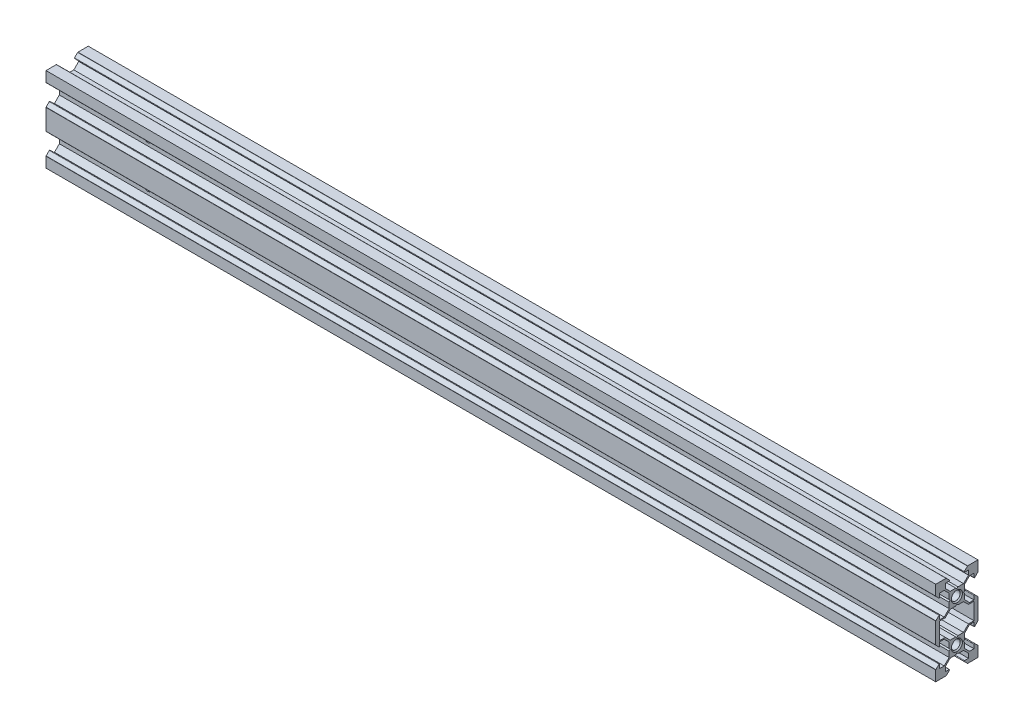
from build123d import *

# Parameters (mm, degrees)
MAIN_BODY_DEPTH        = 200
MAIN_BODY_DEPTH_BACK   = 200
SKETCH2_R              = 2
CHAMFER1_SIZE          = 0.5
CHAMFER2_SIZE          = 0.5
SCREW_HOLES_DEPTH      = 203.243276711
SCREW_HOLES_DEPTH_BACK = 203.243276711
SKETCH3_R              = 1.65


with BuildPart() as part:
    # Sketch2 → Main Body (new, two sides: drawn at the far end of the back side and taken through both)
    with BuildSketch(Plane(origin=(0, 0, 0), x_dir=(0, 0, -1), z_dir=(1, 0, 0)).offset(-MAIN_BODY_DEPTH_BACK)):
        with BuildLine():
            Line((0.5, 3.5), (0, 3))
            Line((0, 3), (-0.5, 3.5))
            Line((-0.5, 3.5), (-3.01, 3.5))
            Line((-3.01, 3.5), (-5.209102089, 5.699102089))
            Line((-5.209102089, 5.699102089), (-5.209102089, 7.699102089))
            Line((-5.209102089, 7.699102089), (-3.479102089, 7.699102089))
            ThreePointArc((-3.479102089, 7.699102089), (-3.294326183, 7.822565403), (-3.337680733, 8.040523446))
            Line((-3.337680733, 8.040523446), (-4.73775216, 9.440594872))
            ThreePointArc((-4.73775216, 9.440594872), (-4.80263683, 9.483949423), (-4.879173516, 9.499173516))
            Line((-4.879173516, 9.499173516), (-9.499173516, 9.499173516))
            Line((-9.499173516, 9.499173516), (-9.499173516, 4.879173516))
            ThreePointArc((-9.499173516, 4.879173516), (-9.483949423, 4.80263683), (-9.440594872, 4.73775216))
            Line((-9.440594872, 4.73775216), (-8.040523446, 3.337680733))
            ThreePointArc((-8.040523446, 3.337680733), (-7.822565403, 3.294326183), (-7.699102089, 3.479102089))
            Line((-7.699102089, 3.479102089), (-7.699102089, 5.209102089))
            Line((-7.699102089, 5.209102089), (-5.699102089, 5.209102089))
            Line((-5.699102089, 5.209102089), (-3.5, 3.01))
            Line((-3.5, 3.01), (-3.5, 0.5))
            Line((-3.5, 0.5), (-3, 0))
            Line((-3, 0), (-3.5, -0.5))
            Line((-3.5, -0.5), (-3.5, -3.01))
            Line((-3.5, -3.01), (-5.699102089, -5.209102089))
            Line((-5.699102089, -5.209102089), (-7.699102089, -5.209102089))
            Line((-7.699102089, -5.209102089), (-7.699102089, -3.479102089))
            ThreePointArc((-7.699102089, -3.479102089), (-7.822565403, -3.294326183), (-8.040523446, -3.337680733))
            Line((-8.040523446, -3.337680733), (-9.440594872, -4.73775216))
            ThreePointArc((-9.440594872, -4.73775216), (-9.483949423, -4.80263683), (-9.499173516, -4.879173516))
            Line((-9.499173516, -4.879173516), (-9.499173516, -14.119173516))
            ThreePointArc((-9.499173516, -14.119173516), (-9.483949423, -14.195710203), (-9.440594872, -14.260594872))
            Line((-9.440594872, -14.260594872), (-8.040523446, -15.660666299))
            ThreePointArc((-8.040523446, -15.660666299), (-7.822565403, -15.704020849), (-7.699102089, -15.519244943))
            Line((-7.699102089, -15.519244943), (-7.699102089, -13.789244943))
            Line((-7.699102089, -13.789244943), (-5.699102089, -13.789244943))
            Line((-5.699102089, -13.789244943), (-3.5, -15.988347032))
            Line((-3.5, -15.988347032), (-3.5, -18.498347032))
            Line((-3.5, -18.498347032), (-3, -18.998347032))
            Line((-3, -18.998347032), (-3.5, -19.498347032))
            Line((-3.5, -19.498347032), (-3.5, -22.008347032))
            Line((-3.5, -22.008347032), (-5.699102089, -24.207449122))
            Line((-5.699102089, -24.207449122), (-7.699102089, -24.207449122))
            Line((-7.699102089, -24.207449122), (-7.699102089, -22.477449122))
            ThreePointArc((-7.699102089, -22.477449122), (-7.822565403, -22.292673215), (-8.040523446, -22.336027766))
            Line((-8.040523446, -22.336027766), (-9.440594872, -23.736099192))
            ThreePointArc((-9.440594872, -23.736099192), (-9.483949423, -23.800983862), (-9.499173516, -23.877520549))
            Line((-9.499173516, -23.877520549), (-9.499173516, -28.497520549))
            Line((-9.499173516, -28.497520549), (-4.879173516, -28.497520549))
            ThreePointArc((-4.879173516, -28.497520549), (-4.80263683, -28.482296455), (-4.73775216, -28.438941905))
            Line((-4.73775216, -28.438941905), (-3.337680733, -27.038870478))
            ThreePointArc((-3.337680733, -27.038870478), (-3.294326183, -26.820912435), (-3.479102089, -26.697449122))
            Line((-3.479102089, -26.697449122), (-5.209102089, -26.697449122))
            Line((-5.209102089, -26.697449122), (-5.209102089, -24.697449122))
            Line((-5.209102089, -24.697449122), (-3.01, -22.498347032))
            Line((-3.01, -22.498347032), (-0.5, -22.498347032))
            Line((-0.5, -22.498347032), (0, -21.998347032))
            Line((0, -21.998347032), (0.5, -22.498347032))
            Line((0.5, -22.498347032), (3.01, -22.498347032))
            Line((3.01, -22.498347032), (5.209102089, -24.697449122))
            Line((5.209102089, -24.697449122), (5.209102089, -26.697449122))
            Line((5.209102089, -26.697449122), (3.479102089, -26.697449122))
            ThreePointArc((3.479102089, -26.697449122), (3.294326183, -26.820912435), (3.337680733, -27.038870478))
            Line((3.337680733, -27.038870478), (4.73775216, -28.438941905))
            ThreePointArc((4.73775216, -28.438941905), (4.80263683, -28.482296455), (4.879173516, -28.497520549))
            Line((4.879173516, -28.497520549), (9.499173516, -28.497520549))
            Line((9.499173516, -28.497520549), (9.499173516, -23.877520549))
            ThreePointArc((9.499173516, -23.877520549), (9.483949423, -23.800983862), (9.440594872, -23.736099192))
            Line((9.440594872, -23.736099192), (8.040523446, -22.336027766))
            ThreePointArc((8.040523446, -22.336027766), (7.822565403, -22.292673215), (7.699102089, -22.477449122))
            Line((7.699102089, -22.477449122), (7.699102089, -24.207449122))
            Line((7.699102089, -24.207449122), (5.699102089, -24.207449122))
            Line((5.699102089, -24.207449122), (3.5, -22.008347032))
            Line((3.5, -22.008347032), (3.5, -19.498347032))
            Line((3.5, -19.498347032), (3, -18.998347032))
            Line((3, -18.998347032), (3.5, -18.498347032))
            Line((3.5, -18.498347032), (3.5, -15.988347032))
            Line((3.5, -15.988347032), (5.699102089, -13.789244943))
            Line((5.699102089, -13.789244943), (7.699102089, -13.789244943))
            Line((7.699102089, -13.789244943), (7.699102089, -15.519244943))
            ThreePointArc((7.699102089, -15.519244943), (7.822565403, -15.704020849), (8.040523446, -15.660666299))
            Line((8.040523446, -15.660666299), (9.440594872, -14.260594872))
            ThreePointArc((9.440594872, -14.260594872), (9.483949423, -14.195710203), (9.499173516, -14.119173516))
            Line((9.499173516, -14.119173516), (9.499173516, -4.879173516))
            ThreePointArc((9.499173516, -4.879173516), (9.483949423, -4.80263683), (9.440594872, -4.73775216))
            Line((9.440594872, -4.73775216), (8.040523446, -3.337680733))
            ThreePointArc((8.040523446, -3.337680733), (7.822565403, -3.294326183), (7.699102089, -3.479102089))
            Line((7.699102089, -3.479102089), (7.699102089, -5.209102089))
            Line((7.699102089, -5.209102089), (5.699102089, -5.209102089))
            Line((5.699102089, -5.209102089), (3.5, -3.01))
            Line((3.5, -3.01), (3.5, -0.5))
            Line((3.5, -0.5), (3, 0))
            Line((3, 0), (3.5, 0.5))
            Line((3.5, 0.5), (3.5, 3.01))
            Line((3.5, 3.01), (5.699102089, 5.209102089))
            Line((5.699102089, 5.209102089), (7.699102089, 5.209102089))
            Line((7.699102089, 5.209102089), (7.699102089, 3.479102089))
            ThreePointArc((7.699102089, 3.479102089), (7.822565403, 3.294326183), (8.040523446, 3.337680733))
            Line((8.040523446, 3.337680733), (9.440594872, 4.73775216))
            ThreePointArc((9.440594872, 4.73775216), (9.483949423, 4.80263683), (9.499173516, 4.879173516))
            Line((9.499173516, 4.879173516), (9.499173516, 9.499173516))
            Line((9.499173516, 9.499173516), (4.879173516, 9.499173516))
            ThreePointArc((4.879173516, 9.499173516), (4.80263683, 9.483949423), (4.73775216, 9.440594872))
            Line((4.73775216, 9.440594872), (3.337680733, 8.040523446))
            ThreePointArc((3.337680733, 8.040523446), (3.294326183, 7.822565403), (3.479102089, 7.699102089))
            Line((3.479102089, 7.699102089), (5.209102089, 7.699102089))
            Line((5.209102089, 7.699102089), (5.209102089, 5.699102089))
            Line((5.209102089, 5.699102089), (3.01, 3.5))
            Line((3.01, 3.5), (0.5, 3.5))
        make_face()
        with Locations((0, -18.998347032)):
            Circle(SKETCH2_R, mode=Mode.SUBTRACT)
        Polygon((-0.5, -3.5), (0, -3), (0.5, -3.5), (3.01, -3.5), (5.209102089, -5.699102089), (7.699102089, -5.699102089), (7.699102089, -13.299244943), (5.209102089, -13.299244943), (3.01, -15.498347032), (0.5, -15.498347032), (0, -15.998347032), (-0.5, -15.498347032), (-3.01, -15.498347032), (-5.209102089, -13.299244943), (-7.699102089, -13.299244943), (-7.699102089, -5.699102089), (-5.209102089, -5.699102089), (-3.01, -3.5), align=None, mode=Mode.SUBTRACT)
        Circle(SKETCH2_R, mode=Mode.SUBTRACT)
    extrude(amount=MAIN_BODY_DEPTH + MAIN_BODY_DEPTH_BACK)

    # Chamfer1
    chamfer1_edges = [part.edges().sort_by_distance(p)[0] for p in [
        (200, 0, 2),
    ]]
    chamfer(chamfer1_edges, length=CHAMFER1_SIZE)

    # Chamfer2
    chamfer2_edges = [part.edges().sort_by_distance(p)[0] for p in [
        (-200, 0, 2),
        (200, -18.998347032, 2),
        (-200, -18.998347032, 2),
    ]]
    chamfer(chamfer2_edges, length=CHAMFER2_SIZE)

    # Sketch3 → Screw Holes (cut, two sides: drawn at the far end of the back side and taken through both)
    with BuildSketch(Plane.XY.offset(-SCREW_HOLES_DEPTH_BACK)):
        with Locations((-160.25, 0)):
            Circle(SKETCH3_R)
        with Locations((-160.25, -18.998347032)):
            Circle(SKETCH3_R)
    extrude(amount=SCREW_HOLES_DEPTH + SCREW_HOLES_DEPTH_BACK, mode=Mode.SUBTRACT)


solid = part.part
